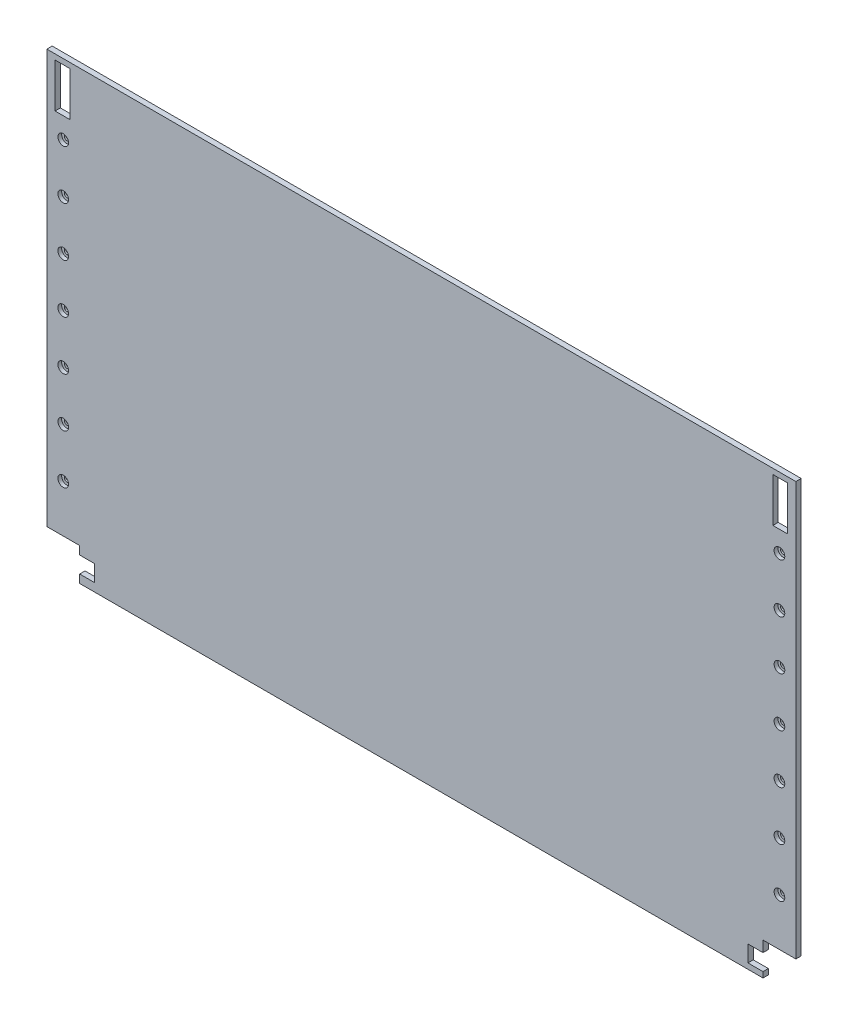
from build123d import *

# Parameters (mm, degrees)
BOSS_EXTRU_1_DEPTH         = 6.5
ESQUISSE2_W                = 18
ESQUISSE2_H                = 53.786822236
ENL_V_MAT_EXTRU_1_DEPTH    = 6.5
D_GAGEMENT_M61_D           = 6.6
R_P_TITION_LIN_AIRE1_COUNT = 7
R_P_TITION_LIN_AIRE1_PITCH = 60


with BuildPart() as part:
    # Esquisse1 → Boss.-Extru.1 (new body)
    with BuildSketch(Plane.XY):
        Polygon((416, -265.000000009), (416, -251.75), (456, -251.75), (456, 251.75), (-456, 251.75), (-456, -251.75), (-416, -251.75), (-416, -261.75000001), (-397.670089581, -261.75000001), (-397.670089581, -281.75000001), (-416, -281.75000001), (-416, -291.75), (416, -291.75), (416, -288.5), (416, -285.000000009), (397.67, -285.000000009), (397.67, -265.000000009), align=None)
    extrude(amount=BOSS_EXTRU_1_DEPTH)

    # Esquisse2 → Enlèv. mat.-Extru.1 (cut)
    with BuildSketch(Plane.XY.offset(6.5)):
        with Locations((-436.999999996, 218.356588882)):
            Rectangle(ESQUISSE2_W, ESQUISSE2_H)
    enl_v_mat_extru_1 = extrude(amount=-ENL_V_MAT_EXTRU_1_DEPTH, mode=Mode.SUBTRACT)

    # Symétrie1: Enlèv. mat.-Extru.1 across plane
    add(enl_v_mat_extru_1.mirror(Plane(origin=(0, 0, 0), x_dir=(0, 0, 1), z_dir=(1, 0, 0))), mode=Mode.SUBTRACT)

    # Dégagement M61 (through all)
    with Locations(Plane(origin=(0, 0, 0), x_dir=(-1, 0, 0), z_dir=(0, 0, -1))):
        with Locations((436.025271582, 166.031516539)):
            Hole(D_GAGEMENT_M61_D / 2)

    # Esquisse5 → Chambrage pour vis à tête ronde bombée M61 (revolve, cut)
    with BuildSketch(Plane(origin=(-436.025271582, 166.031516539, 6.5), x_dir=(0, -1, 0), z_dir=(1, 0, 0))):
        Polygon((0, 0), (0, 6.5), (3.3, 6.5), (3.3, 4.625), (3.325, 4.6), (6.5, 4.6), (6.5, 0), align=None)
    chambrage_pour_vis_t_te_ronde_bomb_e_m = revolve(axis=Axis((-436.025271582, 166.031516539, 12.85), (0, 0, -1)), mode=Mode.SUBTRACT)

    # Répétition linéaire1: Chambrage pour vis à tête ronde bombée M61 ×7
    with Locations(*[(0, -i * R_P_TITION_LIN_AIRE1_PITCH, 0) for i in range(1, R_P_TITION_LIN_AIRE1_COUNT)]):
        add(chambrage_pour_vis_t_te_ronde_bomb_e_m, mode=Mode.SUBTRACT)

    # Symétrie2 copy 1 sketch → Symétrie2 copy 1 (revolve, cut)
    with BuildSketch(Plane(origin=(436.025271582, 106.031516539, 6.5), x_dir=(0, -1, 0), z_dir=(-1, 0, 0))):
        Polygon((0, 0), (0, -6.5), (3.3, -6.5), (3.3, -4.625), (3.325, -4.6), (6.5, -4.6), (6.5, 0), align=None)
    revolve(axis=Axis((436.025271582, 106.031516539, 12.85), (0, 0, 1)), mode=Mode.SUBTRACT)

    # Symétrie2 copy 2 sketch → Symétrie2 copy 2 (revolve, cut)
    with BuildSketch(Plane(origin=(436.025271582, 46.031516539, 6.5), x_dir=(0, -1, 0), z_dir=(-1, 0, 0))):
        Polygon((0, 0), (0, -6.5), (3.3, -6.5), (3.3, -4.625), (3.325, -4.6), (6.5, -4.6), (6.5, 0), align=None)
    revolve(axis=Axis((436.025271582, 46.031516539, 12.85), (0, 0, 1)), mode=Mode.SUBTRACT)

    # Symétrie2 copy 3 sketch → Symétrie2 copy 3 (revolve, cut)
    with BuildSketch(Plane(origin=(436.025271582, -13.968483461, 6.5), x_dir=(0, -1, 0), z_dir=(-1, 0, 0))):
        Polygon((0, 0), (0, -6.5), (3.3, -6.5), (3.3, -4.625), (3.325, -4.6), (6.5, -4.6), (6.5, 0), align=None)
    revolve(axis=Axis((436.025271582, -13.968483461, 12.85), (0, 0, 1)), mode=Mode.SUBTRACT)

    # Symétrie2 copy 4 sketch → Symétrie2 copy 4 (revolve, cut)
    with BuildSketch(Plane(origin=(436.025271582, -73.968483461, 6.5), x_dir=(0, -1, 0), z_dir=(-1, 0, 0))):
        Polygon((0, 0), (0, -6.5), (3.3, -6.5), (3.3, -4.625), (3.325, -4.6), (6.5, -4.6), (6.5, 0), align=None)
    revolve(axis=Axis((436.025271582, -73.968483461, 12.85), (0, 0, 1)), mode=Mode.SUBTRACT)

    # Symétrie2 copy 5 sketch → Symétrie2 copy 5 (revolve, cut)
    with BuildSketch(Plane(origin=(436.025271582, -133.968483461, 6.5), x_dir=(0, -1, 0), z_dir=(-1, 0, 0))):
        Polygon((0, 0), (0, -6.5), (3.3, -6.5), (3.3, -4.625), (3.325, -4.6), (6.5, -4.6), (6.5, 0), align=None)
    revolve(axis=Axis((436.025271582, -133.968483461, 12.85), (0, 0, 1)), mode=Mode.SUBTRACT)

    # Symétrie2 copy 6 sketch → Symétrie2 copy 6 (revolve, cut)
    with BuildSketch(Plane(origin=(436.025271582, -193.968483461, 6.5), x_dir=(0, -1, 0), z_dir=(-1, 0, 0))):
        Polygon((0, 0), (0, -6.5), (3.3, -6.5), (3.3, -4.625), (3.325, -4.6), (6.5, -4.6), (6.5, 0), align=None)
    revolve(axis=Axis((436.025271582, -193.968483461, 12.85), (0, 0, 1)), mode=Mode.SUBTRACT)

    # Symétrie2 copy 7 sketch → Symétrie2 copy 7 (revolve, cut)
    with BuildSketch(Plane(origin=(436.025271582, 166.031516539, 6.5), x_dir=(0, -1, 0), z_dir=(-1, 0, 0))):
        Polygon((0, 0), (0, -6.5), (3.3, -6.5), (3.3, -4.625), (3.325, -4.6), (6.5, -4.6), (6.5, 0), align=None)
    revolve(axis=Axis((436.025271582, 166.031516539, 12.85), (0, 0, 1)), mode=Mode.SUBTRACT)


solid = part.part
